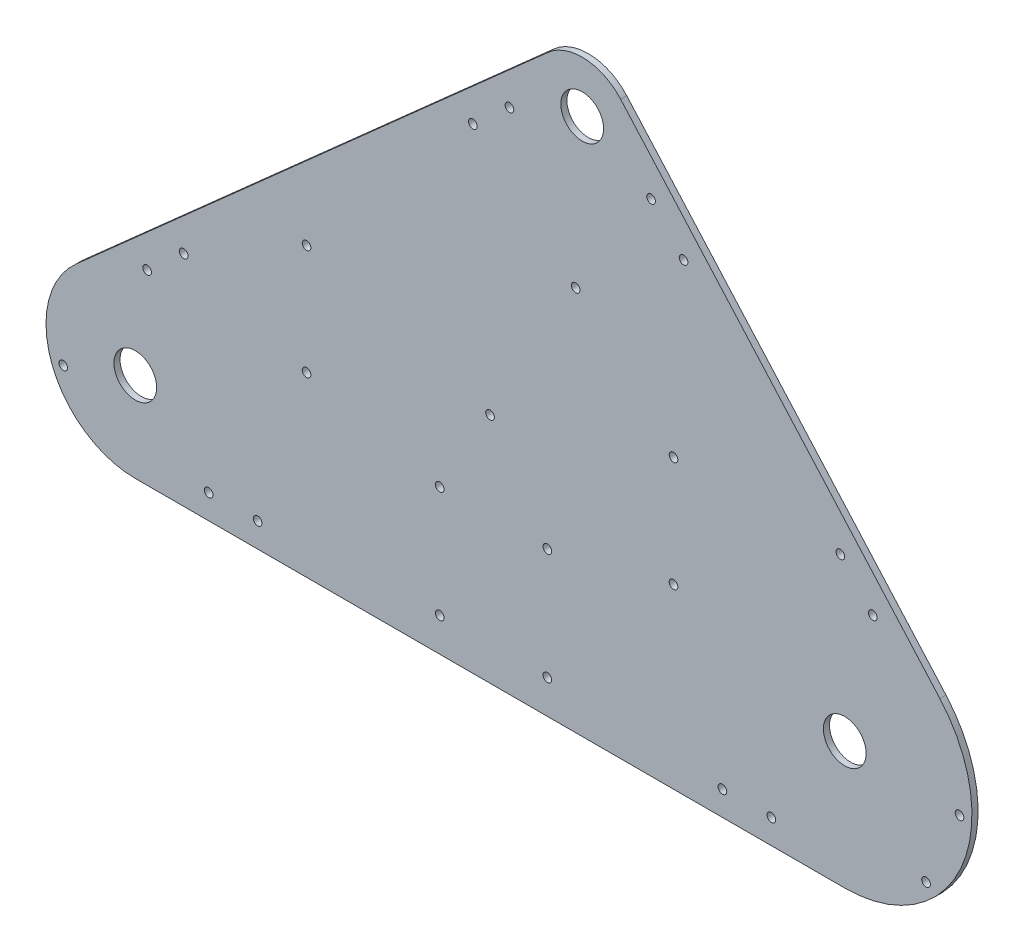
from build123d import *

# Parameters (mm, degrees)
SKETCH1_R             = 11.0998
BOSS_EXTRUDE1_DEPTH   = 3.175
F_8_CLEARANCE_HOLE2_D = 4.4958


with BuildPart() as part:
    # Sketch1 → Boss-Extrude1 (new body)
    with BuildSketch(Plane.XY):
        with BuildLine():
            Line((-188.264639147, 81.011774484), (56.809800323, 298.704514086))
            ThreePointArc((56.809800323, 298.704514086), (76.096805757, 305.388436009), (94.461024604, 296.476710194))
            Line((94.461024604, 296.476710194), (260.194034881, 109.897568099))
            ThreePointArc((260.194034881, 109.897568099), (271.059668812, 38.975929697), (210.82, 0))
            Line((210.82, 0), (-157.48, 0))
            ThreePointArc((-157.48, 0), (-200.811863601, 29.88880366), (-188.264639147, 81.011774484))
        make_face()
        with Locations((-157.48, 46.355)):
            Circle(SKETCH1_R, mode=Mode.SUBTRACT)
        with Locations((74.521510517, 278.765)):
            Circle(SKETCH1_R, mode=Mode.SUBTRACT)
        with Locations((210.82, 66.04)):
            Circle(SKETCH1_R, mode=Mode.SUBTRACT)
    extrude(amount=BOSS_EXTRUDE1_DEPTH)

    # #8 Clearance Hole2 (through all)
    with Locations(Plane.XY.offset(3.175)):
        with Locations((17.768914495, 247.038768822), (36.758927911, 263.907064244), (110.26846103, 259.557542359), (127.136756453, 240.567528943), (208.528289616, 148.938453927), (225.396585039, 129.948440511), (270.394698688, 62.514995218), (253.027203769, 23.832796231), (172.72, 12.7), (147.32, 12.7), (-93.98, 12.7), (-119.38, 12.7), (-194.875991874, 32.144446994), (-151.345471312, 96.81921091), (-132.355457896, 113.687506333), (-68.58, 149.225), (-68.58, 92.075), (121.92, 92.075), (121.92, 149.225), (71.12, 200.025), (26.67, 120.65), (0.55626, 75.2475), (56.43626, 75.2475), (56.43626, 17.4625), (0.55626, 17.4625)):
            Hole(F_8_CLEARANCE_HOLE2_D / 2)


solid = part.part
